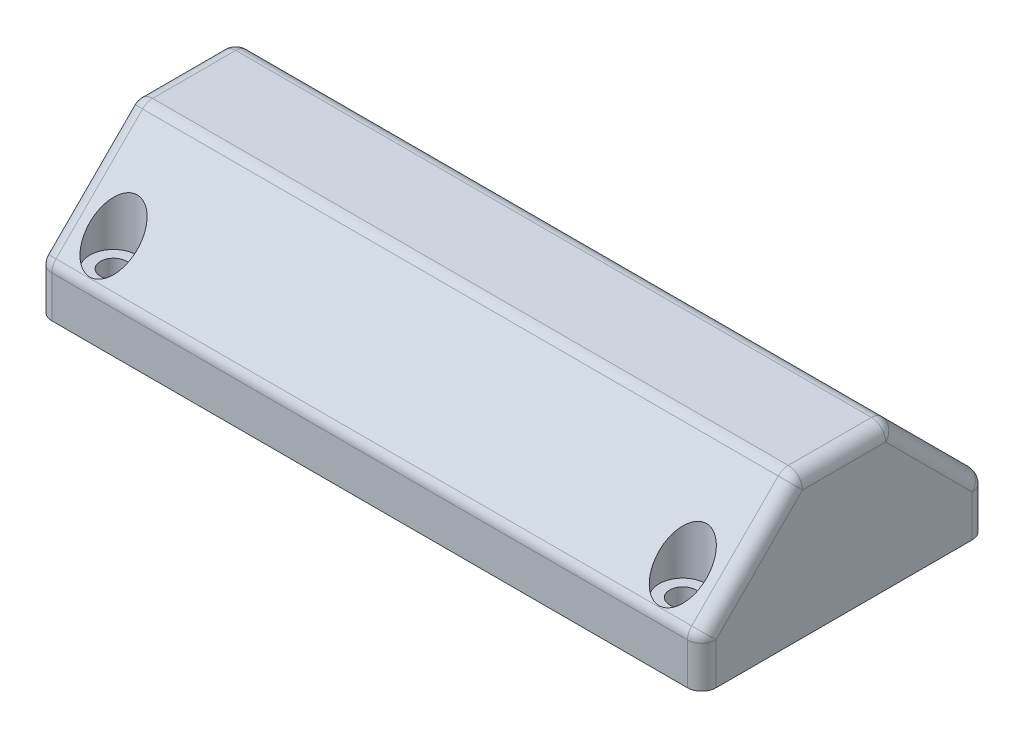
from build123d import *

# Parameters (mm, degrees)
SKETCH1_R           = 2.75
SKETCH1_W           = 130
SKETCH1_H           = 38
BOSS_EXTRUDE1_DEPTH = 10
SKETCH2_W           = 20
SKETCH2_H           = 20
BOSS_EXTRUDE3_DEPTH = 140
SKETCH3_R           = 5
CUT_EXTRUDE1_DEPTH  = 79.74007874
FILLET1_R           = 3


with BuildPart() as part:
    # Sketch1 → Boss-Extrude1 (new body)
    # profile 1 of 6: a face of its own
    with BuildSketch(Plane(origin=(0, 0, 0), x_dir=(1, 0, 0), z_dir=(0, 1, 0))):
        with BuildLine():
            Line((70, 30), (67, 30))
            ThreePointArc((67, 30), (69.121320344, 29.121320344), (70, 27))
            Line((70, 27), (70, 30))
        make_face()
    # profile 2 of 6: a face of its own
    with BuildSketch(Plane(origin=(0, 0, 0), x_dir=(1, 0, 0), z_dir=(0, 1, 0))):
        with BuildLine():
            ThreePointArc((70, 27), (69.121320344, 29.121320344), (67, 30))
            Line((67, 30), (-67, 30))
            ThreePointArc((-67, 30), (-69.121320344, 29.121320344), (-70, 27))
            Line((-70, 27), (-70, -27))
            ThreePointArc((-70, -27), (-69.121320344, -29.121320344), (-67, -30))
            Line((-67, -30), (67, -30))
            ThreePointArc((67, -30), (69.121320344, -29.121320344), (70, -27))
            Line((70, -27), (70, 27))
        make_face()
        with Locations(Location((-60, -24, 0), (0, 0, 270))):
            Circle(SKETCH1_R, mode=Mode.SUBTRACT)
        with Locations(Location((60, 24, 0), (0, 0, 270))):
            Circle(SKETCH1_R, mode=Mode.SUBTRACT)
        with Locations(Location((60, -24, 0), (0, 0, 270))):
            Circle(SKETCH1_R, mode=Mode.SUBTRACT)
        with Locations(Location((-60, 24, 0), (0, 0, 270))):
            Circle(SKETCH1_R, mode=Mode.SUBTRACT)
        Rectangle(SKETCH1_W, SKETCH1_H, mode=Mode.SUBTRACT)
    # profile 3 of 6: a face of its own
    with BuildSketch(Plane(origin=(0, 0, 0), x_dir=(1, 0, 0), z_dir=(0, 1, 0))):
        with BuildLine():
            Line((70, -30), (70, -27))
            ThreePointArc((70, -27), (69.121320344, -29.121320344), (67, -30))
            Line((67, -30), (70, -30))
        make_face()
    # profile 4 of 6: a face of its own
    with BuildSketch(Plane(origin=(0, 0, 0), x_dir=(1, 0, 0), z_dir=(0, 1, 0))):
        with BuildLine():
            ThreePointArc((-70, 27), (-69.121320344, 29.121320344), (-67, 30))
            Line((-67, 30), (-70, 30))
            Line((-70, 30), (-70, 27))
        make_face()
    # profile 5 of 6: a face of its own
    with BuildSketch(Plane(origin=(0, 0, 0), x_dir=(1, 0, 0), z_dir=(0, 1, 0))):
        with BuildLine():
            ThreePointArc((-67, -30), (-69.121320344, -29.121320344), (-70, -27))
            Line((-70, -27), (-70, -30))
            Line((-70, -30), (-67, -30))
        make_face()
    # profile 6 of 6: a face of its own
    with BuildSketch(Plane(origin=(0, 0, 0), x_dir=(1, 0, 0), z_dir=(0, 1, 0))):
        Rectangle(SKETCH1_W, SKETCH1_H)
    extrude(amount=BOSS_EXTRUDE1_DEPTH)

    # Sketch2 → Boss-Extrude3 (add, through all)
    with BuildSketch(Plane.ZY.offset(70)):
        Polygon((-10, 10), (-10, 30), (-30, 10), align=None)
        with Locations((0, 20)):
            Rectangle(SKETCH2_W, SKETCH2_H)
        Polygon((30, 10), (10, 30), (10, 10), align=None)
    extrude(amount=-BOSS_EXTRUDE3_DEPTH)

    # Sketch3 → Cut-Extrude1 (cut, through all)
    with BuildSketch(Plane(origin=(0, 10, 0), x_dir=(1, 0, 0), z_dir=(0, 1, 0))):
        with Locations(Location((60, 24, 0), (0, 0, 90))):
            Circle(SKETCH3_R)
        with Locations(Location((60, -24, 0), (0, 0, 270))):
            Circle(SKETCH3_R)
        with Locations(Location((-60, 24, 0), (0, 0, 90))):
            Circle(SKETCH3_R)
        with Locations(Location((-60, -24, 0), (0, 0, 270))):
            Circle(SKETCH3_R)
    extrude(amount=CUT_EXTRUDE1_DEPTH, mode=Mode.SUBTRACT)

    # Fillet1
    fillet1_edges = [part.edges().sort_by_distance(p)[0] for p in [
        (0, 10, -30),
        (70, 5, 30),
        (-70, 5, 30),
        (-70, 5, -30),
        (70, 5, -30),
        (0, 10, 30),
        (-70, 20, -20),
        (70, 30, 0),
        (0, 30, -10),
        (-70, 20, 20),
        (0, 30, 10),
        (70, 20, -20),
        (70, 20, 20),
        (-70, 30, 0),
    ]]
    fillet(fillet1_edges, radius=FILLET1_R)


solid = part.part
